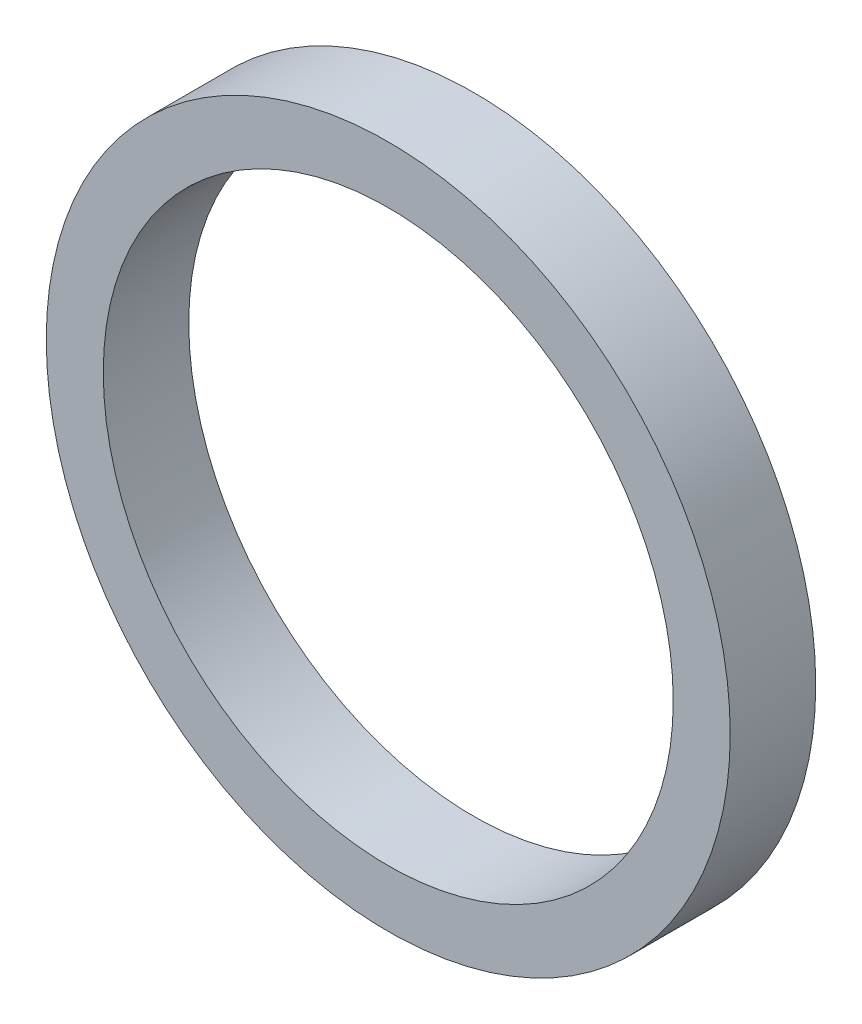
from build123d import *

# Parameters (mm, degrees)
SKETCH1_R           = 240
BOSS_EXTRUDE1_DEPTH = 60
SKETCH2_R           = 200
CUT_EXTRUDE1_DEPTH  = 60


with BuildPart() as part:
    # Sketch1 → Boss-Extrude1 (new body)
    with BuildSketch(Plane.XY):
        Circle(SKETCH1_R)
    extrude(amount=BOSS_EXTRUDE1_DEPTH)

    # Sketch2 → Cut-Extrude1 (cut)
    with BuildSketch(Plane.XY.offset(60)):
        Circle(SKETCH2_R)
    extrude(amount=-CUT_EXTRUDE1_DEPTH, mode=Mode.SUBTRACT)


solid = part.part
